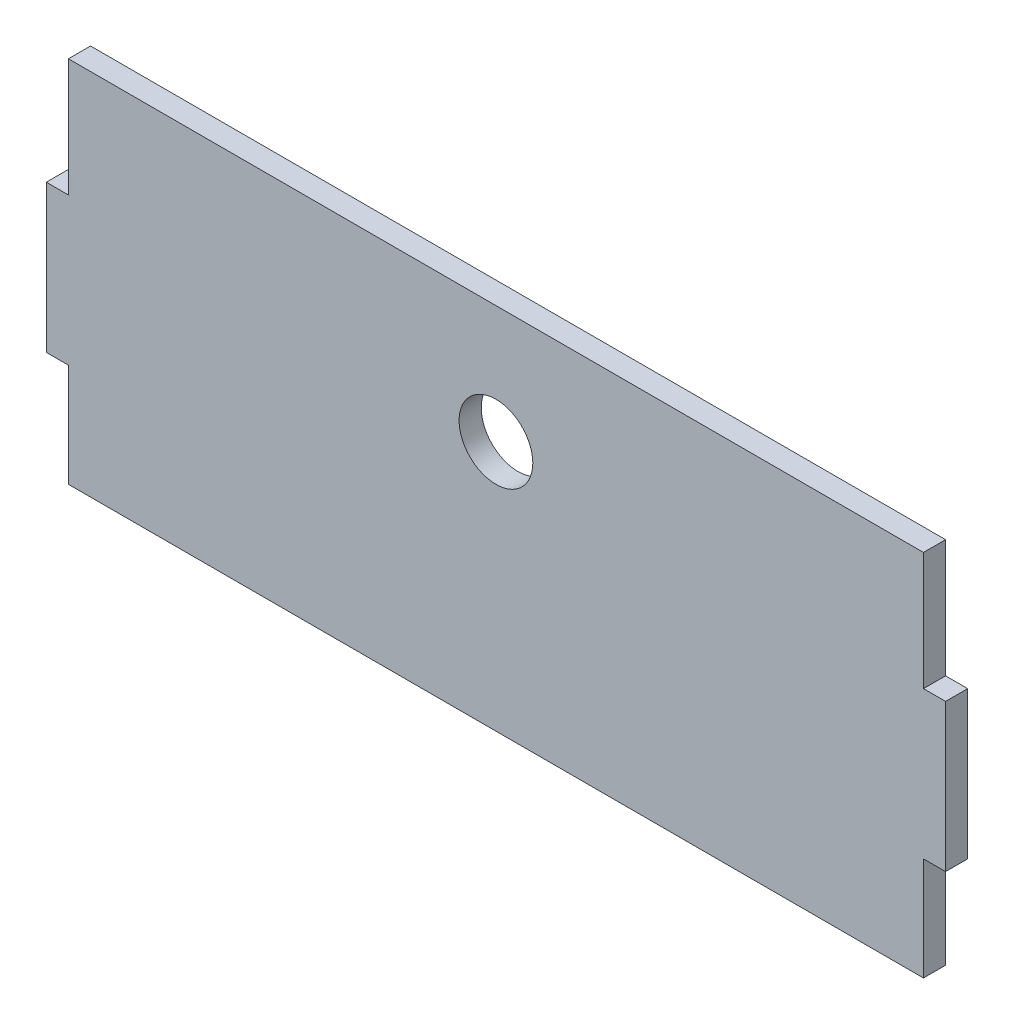
from build123d import *

# Parameters (mm, degrees)
SKETCH1_R           = 5
BOSS_EXTRUDE1_DEPTH = 3


with BuildPart() as part:
    # Sketch1 → Boss-Extrude1 (new body)
    with BuildSketch(Plane.XY):
        Polygon((-61, 10), (-61, -10), (-58, -10), (-58, -24), (58, -24), (58, -10), (61, -10), (61, 10), (58, 10), (58, 26), (-58, 26), (-58, 10), align=None)
        with Locations((0, 10)):
            Circle(SKETCH1_R, mode=Mode.SUBTRACT)
    extrude(amount=BOSS_EXTRUDE1_DEPTH)


solid = part.part
